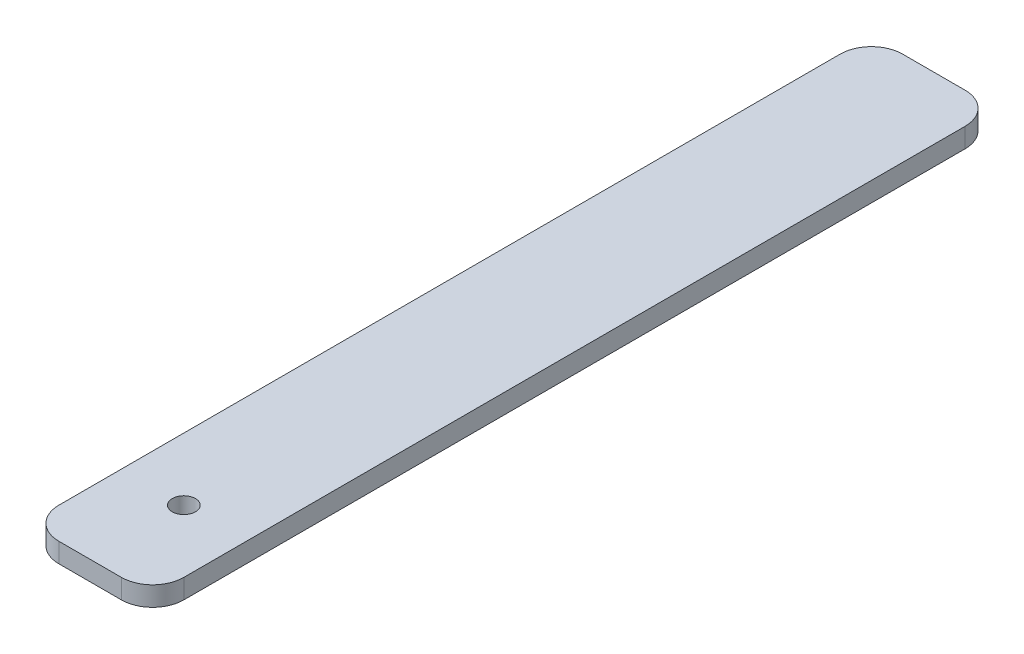
from build123d import *

# Parameters (mm, degrees)
SKETCH1_W           = 10.16
SKETCH1_H           = 68.58
SKETCH1_R           = 0.9398
BOSS_EXTRUDE1_DEPTH = 1.5875
FILLET1_R           = 2.54


with BuildPart() as part:
    # Sketch1 → Boss-Extrude1 (new body)
    with BuildSketch(Plane(origin=(0, 0, 0), x_dir=(1, 0, 0), z_dir=(0, 1, 0))):
        with Locations((5.08, 34.29)):
            Rectangle(SKETCH1_W, SKETCH1_H)
        with Locations(Location((5.08, 7.62, 0), (0, 0, 270))):
            Circle(SKETCH1_R, mode=Mode.SUBTRACT)
    extrude(amount=BOSS_EXTRUDE1_DEPTH)

    # Fillet1
    fillet1_edges = [part.edges().sort_by_distance(p)[0] for p in [
        (0, 0.79375, -68.58),
        (10.16, 0.79375, -68.58),
        (10.16, 0.79375, 0),
        (0, 0.79375, 0),
    ]]
    fillet(fillet1_edges, radius=FILLET1_R)


solid = part.part
